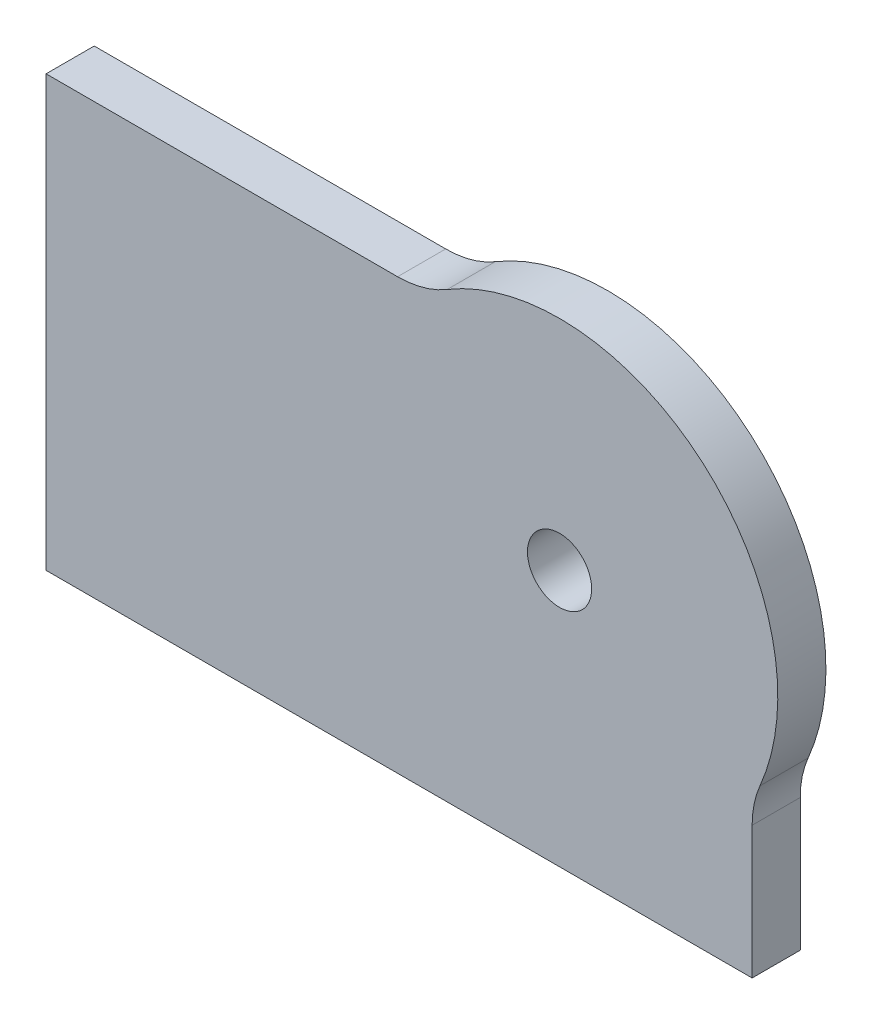
from build123d import *

# Parameters (mm, degrees)
SKETCH1_R      = 6.35
EXTRUDE1_DEPTH = 9.525


with BuildPart() as part:
    # Sketch1 → Extrude1 (new body)
    with BuildSketch(Plane.XY):
        with BuildLine():
            Line((0, 0), (139.7, 0))
            Line((139.7, 0), (139.7, 26.173786324))
            ThreePointArc((139.7, 26.173786324), (140.092825695, 30.022467519), (141.255102041, 33.712423164))
            ThreePointArc((141.255102041, 33.712423164), (130.016323799, 83.311919995), (79.358899418, 87.811428571))
            ThreePointArc((79.358899418, 87.811428571), (74.63797582, 85.782960673), (69.546649161, 85.09))
            Line((69.546649161, 85.09), (0, 85.09))
            Line((0, 85.09), (0, 0))
        make_face()
        with Locations(Location((101.6, 50.8, 0), (0, 0, 180))):
            Circle(SKETCH1_R, mode=Mode.SUBTRACT)
    extrude(amount=EXTRUDE1_DEPTH)


solid = part.part
